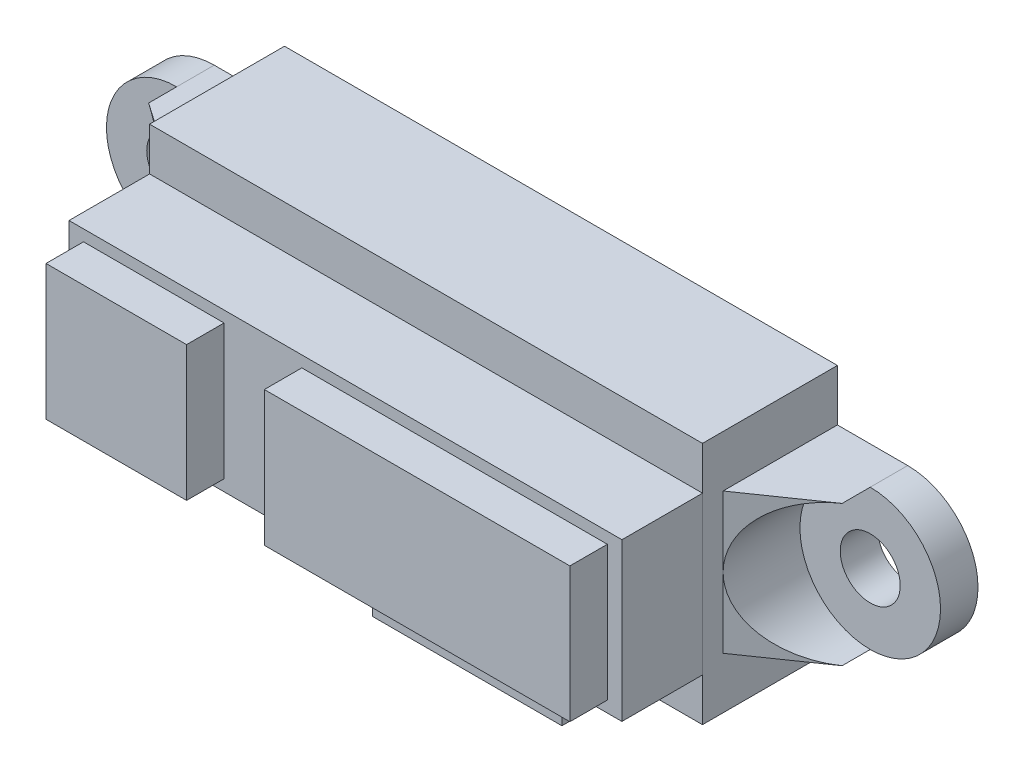
from build123d import *

# Parameters (mm, degrees)
SKETCH1_W           = 29.5
SKETCH1_H           = 13
BOSS_EXTRUDE1_DEPTH = 7.2
BOSS_EXTRUDE2_DEPTH = 4.3
SKETCH3_W           = 7.5
SKETCH3_H           = 7.2
SKETCH3_W_2         = 16.3
BOSS_EXTRUDE3_DEPTH = 2
SKETCH4_R           = 1.6
BOSS_EXTRUDE6_DEPTH = 2
SKETCH6_W           = 10.1
SKETCH6_H           = 6
BOSS_EXTRUDE7_DEPTH = 5
SKETCH7_W           = 3.75
SKETCH7_H           = 7.5
BOSS_EXTRUDE8_DEPTH = 4.1
CUT_EXTRUDE1_START  = -4.1
SKETCH8_R           = 3.75
CUT_EXTRUDE1_DEPTH  = 4.1
CUT_EXTRUDE2_DEPTH  = 31.681835017


with BuildPart() as part:
    # Sketch1 → Boss-Extrude1 (new body)
    with BuildSketch(Plane.XY):
        Rectangle(SKETCH1_W, SKETCH1_H)
    extrude(amount=BOSS_EXTRUDE1_DEPTH)

    # Sketch2 → Boss-Extrude2 (add)
    with BuildSketch(Plane.XY.offset(7.2)):
        Polygon((-14.746484108, 4.199496061), (14.753515892, 4.199496061), (14.75, -4.200497315), (-14.757033461, -4.200497315), align=None)
    extrude(amount=BOSS_EXTRUDE2_DEPTH)

    # Sketch3 → Boss-Extrude3 (add)
    with BuildSketch(Plane.XY.offset(11.5)):
        with Locations((-10.225, 0)):
            Rectangle(SKETCH3_W, SKETCH3_H)
        with Locations((5.825, 0)):
            Rectangle(SKETCH3_W_2, SKETCH3_H)
    extrude(amount=BOSS_EXTRUDE3_DEPTH)

    # Sketch4 → Boss-Extrude6 (add)
    # profile 1 of 2: a face of its own
    with BuildSketch(Plane(origin=(0, 0, 0), x_dir=(-1, 0, 0), z_dir=(0, 0, -1))):
        with BuildLine():
            Line((-14.75, 3.75), (-14.75, -3.75))
            Line((-14.75, -3.75), (-18.5, -3.75))
            ThreePointArc((-18.5, -3.75), (-22.25, 0), (-18.5, 3.75))
            Line((-18.5, 3.75), (-14.75, 3.75))
        make_face()
        with Locations(Location((-18.5, 0, 0), (0, 0, 180))):
            Circle(SKETCH4_R, mode=Mode.SUBTRACT)
    # profile 2 of 2: a face of its own
    with BuildSketch(Plane(origin=(0, 0, 0), x_dir=(-1, 0, 0), z_dir=(0, 0, -1))):
        with BuildLine():
            Line((18.5, 3.75), (14.75, 3.75))
            Line((14.75, 3.75), (14.75, -3.75))
            Line((14.75, -3.75), (18.5, -3.75))
            ThreePointArc((18.5, -3.75), (22.25, 0), (18.5, 3.75))
        make_face()
        with Locations((18.5, 0)):
            Circle(SKETCH4_R, mode=Mode.SUBTRACT)
    extrude(amount=-BOSS_EXTRUDE6_DEPTH)

    # Sketch6 → Boss-Extrude7 (add)
    with BuildSketch(Plane(origin=(0, 0, 0), x_dir=(-1, 0, 0), z_dir=(0, 0, -1))):
        with Locations((0, -9.5)):
            Rectangle(SKETCH6_W, SKETCH6_H)
    extrude(amount=-BOSS_EXTRUDE7_DEPTH)

    # Sketch7 → Boss-Extrude8 (add)
    with BuildSketch(Plane.XY.offset(2)):
        with Locations((-16.625, 0)):
            Rectangle(SKETCH7_W, SKETCH7_H)
        with Locations((16.625, 0)):
            Rectangle(SKETCH7_W, SKETCH7_H)
    extrude(amount=BOSS_EXTRUDE8_DEPTH)

    # Sketch8 → Cut-Extrude1 (cut)
    with BuildSketch(Plane.XY.offset(6.1).offset(CUT_EXTRUDE1_START)):
        with Locations((-18.5, 0)):
            Circle(SKETCH8_R)
        with Locations((18.5, 0)):
            Circle(SKETCH8_R)
    extrude(amount=CUT_EXTRUDE1_DEPTH, mode=Mode.SUBTRACT)

    # Sketch9 → Cut-Extrude2 (cut, through all)
    with BuildSketch(Plane(origin=(0, 3.75, 0), x_dir=(1, 0, 0), z_dir=(0, 1, 0))):
        Polygon((-18.5, -3.5), (-14.75, -6.1), (-18.5, -6.1), align=None)
        Polygon((18.5, -6.1), (18.5, -3.5), (14.75, -6.1), align=None)
    extrude(amount=-CUT_EXTRUDE2_DEPTH, mode=Mode.SUBTRACT)


solid = part.part
